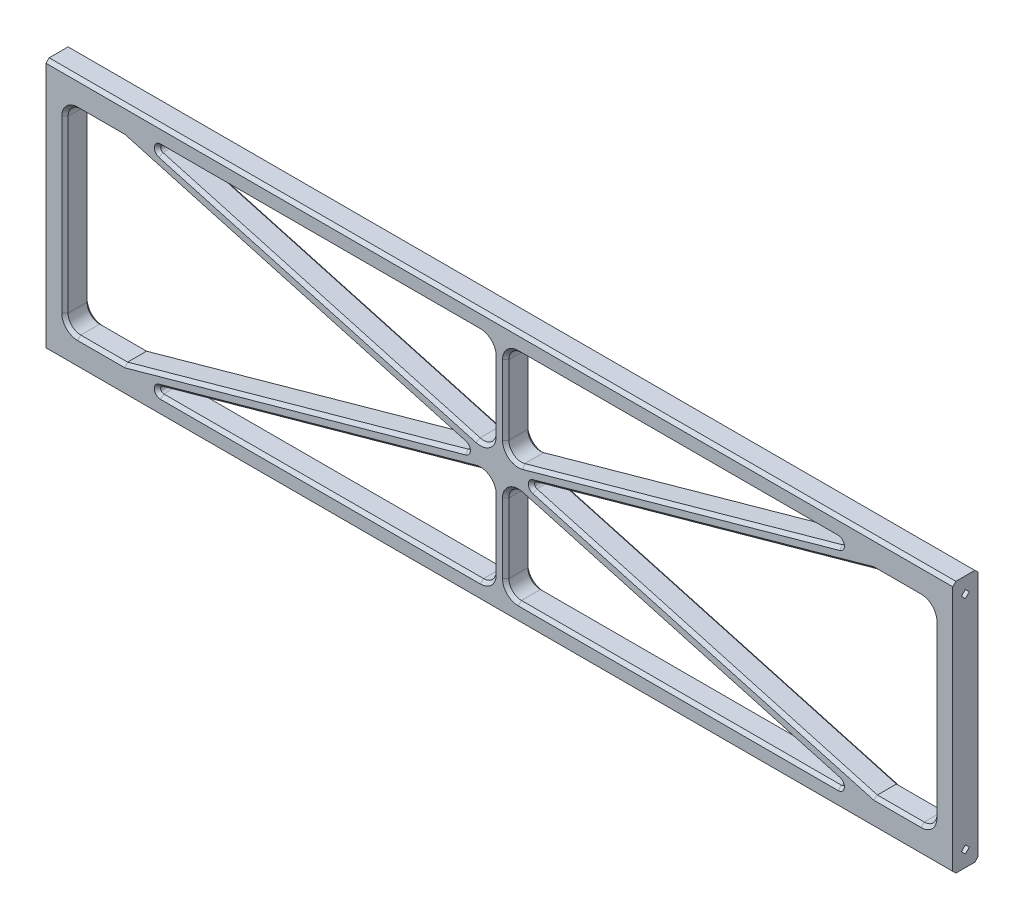
from build123d import *

# Parameters (mm, degrees)
AUFSATZ_LINEAR_AUSTRAGEN1_DEPTH      = 4
AUFSATZ_LINEAR_AUSTRAGEN1_DEPTH_BACK = 4
SKIZZE1_W                            = 287
SKIZZE1_H                            = 80
SCHNITT_LINEAR_AUSTRAGEN1_DEPTH      = 20
SCHNITT_LINEAR_AUSTRAGEN2_DEPTH      = 150.024326873
SCHNITT_LINEAR_AUSTRAGEN2_DEPTH_BACK = 150.024326873
VERRUNDUNG1_R                        = 4
VERRUNDUNG2_R                        = 1
FASE1_SIZE                           = 1


with BuildPart() as part:
    # Skizze1 → Aufsatz-Linear austragen1 (new, two sides: drawn at the far end of the back side and taken through both)
    with BuildSketch(Plane.XY.offset(-AUFSATZ_LINEAR_AUSTRAGEN1_DEPTH_BACK)):
        Rectangle(SKIZZE1_W, SKIZZE1_H)
    extrude(amount=AUFSATZ_LINEAR_AUSTRAGEN1_DEPTH + AUFSATZ_LINEAR_AUSTRAGEN1_DEPTH_BACK)

    # Skizze2 → Schnitt-Linear austragen1 (cut)
    with BuildSketch(Plane.ZY.offset(143.5)):
        Polygon((1.25, 35), (0, 36.25), (-1.25, 35), (0, 33.75), align=None)
        Polygon((-1.25, -35), (0, -33.75), (1.25, -35), (0, -36.25), align=None)
    schnitt_linear_austragen1 = extrude(amount=-SCHNITT_LINEAR_AUSTRAGEN1_DEPTH, mode=Mode.SUBTRACT)

    # Spiegeln1: Schnitt-Linear austragen1 across plane
    add(schnitt_linear_austragen1.mirror(Plane(origin=(0, 0, 0), x_dir=(0, 0, 1), z_dir=(1, 0, 0))), mode=Mode.SUBTRACT)

    # Skizze3 → Schnitt-Linear austragen2 (cut, two sides: drawn at the far end of the back side and taken through both)
    with BuildSketch(Plane.XY.offset(-SCHNITT_LINEAR_AUSTRAGEN2_DEPTH_BACK)):
        Polygon((-114.526468265, 34), (-2, 34), (-2, 2.633737069), align=None)
        Polygon((-137.5, 31), (-137.5, 0), (-137.5, -31), (-118.661031735, -31), (-7.448531735, 0), (-118.661031735, 31), align=None)
        Polygon((-2, -34), (-2, -2.633737069), (-114.526468265, -34), align=None)
        Polygon((118.661031735, -31), (137.5, -31), (137.5, 0), (137.5, 31), (118.661031735, 31), (7.448531735, 0), align=None)
        Polygon((114.526468265, -34), (2, -34), (2, -2.633737069), align=None)
        Polygon((2, 2.633737069), (114.526468265, 34), (2, 34), align=None)
    extrude(amount=SCHNITT_LINEAR_AUSTRAGEN2_DEPTH + SCHNITT_LINEAR_AUSTRAGEN2_DEPTH_BACK, mode=Mode.SUBTRACT)

    # Verrundung1
    verrundung1_edges = [part.edges().sort_by_distance(p)[0] for p in [
        (-2, 2.633737069, 0),
        (-2, -2.633737069, 0),
        (-2, -34, 0),
        (-2, 34, 0),
        (-137.5, -31, 0),
        (-137.5, 31, 0),
        (137.5, -31, 0),
        (137.5, 31, 0),
        (2, -34, 0),
        (2, -2.633737069, 0),
        (2, 2.633737069, 0),
        (2, 34, 0),
    ]]
    fillet(verrundung1_edges, radius=VERRUNDUNG1_R)

    # Verrundung2
    verrundung2_edges = [part.edges().sort_by_distance(p)[0] for p in [
        (-114.526468265, -34, 0),
        (-114.526468265, 34, 0),
        (114.526468265, -34, 0),
        (114.526468265, 34, 0),
        (7.448531735, 0, 0),
        (-7.448531735, 0, 0),
    ]]
    fillet(verrundung2_edges, radius=VERRUNDUNG2_R)

    # Fase1
    fase1_edges = [part.edges().sort_by_distance(p)[0] for p in [
        (-64.782660021, -15.981638547, -4),
        (-136.328427125, -29.828427125, -4),
        (-126.080515867, -31, -4),
        (-64.782660021, 15.981638547, -4),
        (-137.5, 0, -4),
        (-136.328427125, 29.828427125, -4),
        (-126.080515867, 31, -4),
        (-56.607351199, -34, -4),
        (-3.171572875, -32.828427125, -4),
        (-108.205479137, -33.13550444, -4),
        (-2, -18.950605603, -4),
        (-57.278624435, -18.04241287, -4),
        (-3.58092463, -4.71560697, -4),
        (-57.278624435, 18.04241287, -4),
        (-3.58092463, 4.71560697, -4),
        (-108.205479137, 33.13550444, -4),
        (-2, 18.950605603, -4),
        (-56.607351199, 34, -4),
        (-3.171572875, 32.828427125, -4),
        (0, 40, -4),
        (0, -40, -4),
        (0, -40, 4),
        (0, 40, 4),
        (-3.171572875, -32.828427125, 4),
        (-2, -18.950605603, 4),
        (-56.607351199, -34, 4),
        (-3.58092463, -4.71560697, 4),
        (-108.205479137, -33.13550444, 4),
        (-57.278624435, -18.04241287, 4),
        (-126.080515867, -31, 4),
        (-136.328427125, -29.828427125, 4),
        (-64.782660021, -15.981638547, 4),
        (-126.080515867, 31, 4),
        (-136.328427125, 29.828427125, 4),
        (-137.5, 0, 4),
        (-64.782660021, 15.981638547, 4),
        (-3.58092463, 4.71560697, 4),
        (-2, 18.950605603, 4),
        (-57.278624435, 18.04241287, 4),
        (-3.171572875, 32.828427125, 4),
        (-108.205479137, 33.13550444, 4),
        (-56.607351199, 34, 4),
        (-10.172797602, 0, 4),
        (3.58092463, -4.71560697, -4),
        (2, -18.950605603, -4),
        (57.278624435, -18.04241287, -4),
        (3.171572875, -32.828427125, -4),
        (108.205479137, -33.13550444, -4),
        (56.607351199, -34, -4),
        (64.782660021, 15.981638547, -4),
        (10.172797602, 0, -4),
        (64.782660021, -15.981638547, -4),
        (3.171572875, 32.828427125, -4),
        (2, 18.950605603, -4),
        (56.607351199, 34, -4),
        (3.58092463, 4.71560697, -4),
        (108.205479137, 33.13550444, -4),
        (57.278624435, 18.04241287, -4),
        (126.080515867, -31, 4),
        (126.080515867, 31, 4),
        (136.328427125, -29.828427125, 4),
        (136.328427125, 29.828427125, 4),
        (137.5, 0, 4),
        (3.171572875, 32.828427125, 4),
        (2, 18.950605603, 4),
        (56.607351199, 34, 4),
        (3.58092463, 4.71560697, 4),
        (108.205479137, 33.13550444, 4),
        (57.278624435, 18.04241287, 4),
        (64.782660021, 15.981638547, 4),
        (10.172797602, 0, 4),
        (64.782660021, -15.981638547, 4),
        (3.58092463, -4.71560697, 4),
        (2, -18.950605603, 4),
        (57.278624435, -18.04241287, 4),
        (3.171572875, -32.828427125, 4),
        (108.205479137, -33.13550444, 4),
        (56.607351199, -34, 4),
        (-10.172797602, 0, -4),
        (126.080515867, -31, -4),
        (126.080515867, 31, -4),
        (136.328427125, -29.828427125, -4),
        (136.328427125, 29.828427125, -4),
        (137.5, 0, -4),
    ]]
    chamfer(fase1_edges, length=FASE1_SIZE)


solid = part.part
